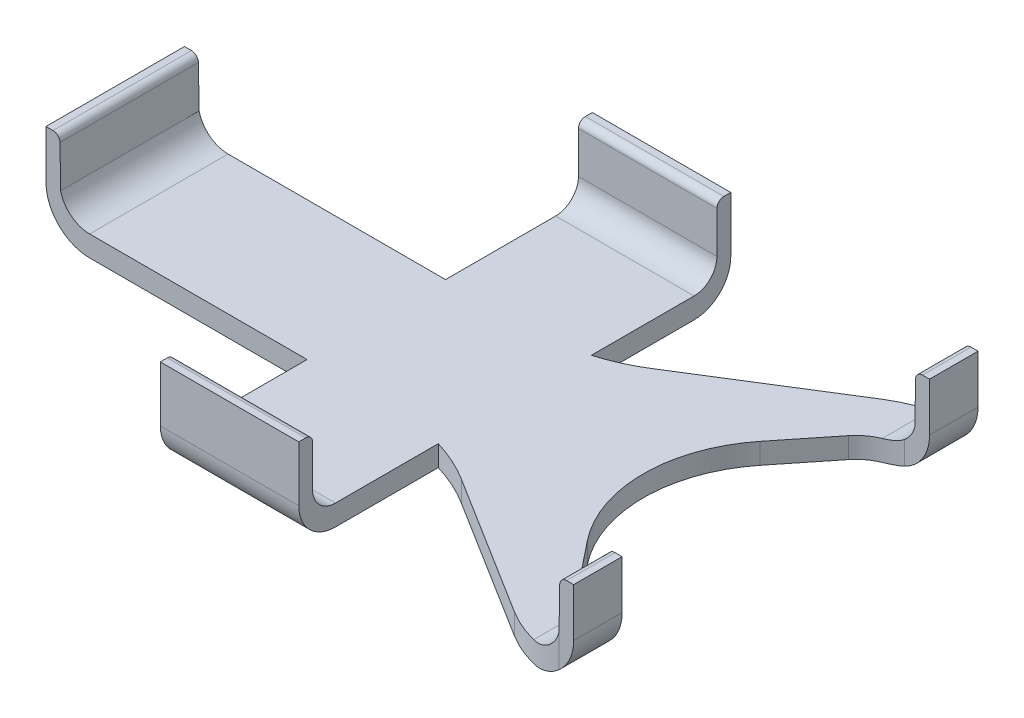
from build123d import *

# Parameters (mm, degrees)
BOSS_EXTRUDE1_DEPTH     = 30
FILLET2_R               = 1
FILLET2_OF_MIRROR4_R    = 1
CUT_EXTRUDE2_DEPTH      = 10.3
CUT_EXTRUDE2_DEPTH_BACK = 3
SKETCH4_OUTSIDE_W       = 120.12
SKETCH4_OUTSIDE_H       = 84.7
BOSS_EXTRUDE2_DEPTH     = 10
FILLET1_R               = 1
FILLET1_OF_MIRROR3_R    = 1


with BuildPart() as part:
    # Sketch3 → Boss-Extrude1 (new, symmetric)
    with BuildSketch(Plane.XY):
        with BuildLine():
            Line((-45.71, 2), (-45.59234107, -4.9990111))
            ThreePointArc((-45.59234107, -4.9990111), (-44.074043193, -7.375333149), (-41.41, -8.3))
            Line((-41.41, -8.3), (0, -8.3))
            Line((0, -8.3), (0, -11.3))
            Line((0, -11.3), (-41.41, -11.3))
            ThreePointArc((-41.41, -11.3), (-45.864772721, -9.454772721), (-47.71, -5))
            Line((-47.71, -5), (-47.71, 2))
            Line((-47.71, 2), (-45.71, 2))
        make_face()
    boss_extrude1 = extrude(amount=BOSS_EXTRUDE1_DEPTH, both=True)

    # Fillet2
    fillet2_edges = [part.edges().sort_by_distance(p)[0] for p in [
        (-45.71, 2, 0),
    ]]
    fillet(fillet2_edges, radius=FILLET2_R)

    # Mirror4: Boss-Extrude1 across plane
    add(boss_extrude1.mirror(Plane(origin=(0, 0, 0), x_dir=(0, 0, 1), z_dir=(1, 0, 0))))

    # Fillet2 of Mirror4
    fillet2_of_mirror4_edges = [part.edges().sort_by_distance(p)[0] for p in [
        (45.71, 2, 0),
    ]]
    fillet(fillet2_of_mirror4_edges, radius=FILLET2_OF_MIRROR4_R)

    # Sketch4 outside → Cut-Extrude2 (cut, two sides: drawn at the far end of the back side and taken through both)
    with BuildSketch(Plane(origin=(0, -8.3, 0), x_dir=(1, 0, 0), z_dir=(0, 1, 0)).offset(-CUT_EXTRUDE2_DEPTH_BACK)):
        Rectangle(SKETCH4_OUTSIDE_W, SKETCH4_OUTSIDE_H)
        with BuildLine():
            Line((-47.71, 10), (2.828114646, 10))
            ThreePointArc((2.828114646, 10), (9.721935767, 10.969285688), (16.081190316, 13.801981572))
            Line((16.081190316, 13.801981572), (36.574790585, 26.614652531))
            ThreePointArc((36.574790585, 26.614652531), (40.899083679, 28.540885732), (45.586882041, 29.2))
            Line((45.586882041, 29.2), (47.71, 29.2))
            Line((47.71, 29.2), (47.71, 22.2))
            Line((47.71, 22.2), (44.078732881, 22.2))
            ThreePointArc((44.078732881, 22.2), (41.043221434, 21.507588307), (38.608231021, 19.567334358))
            Line((38.608231021, 19.567334358), (32.948592182, 12.478098166))
            ThreePointArc((32.948592182, 12.478098166), (28.578597498, 0), (32.948592182, -12.478098166))
            Line((32.948592182, -12.478098166), (38.608231021, -19.567334358))
            ThreePointArc((38.608231021, -19.567334358), (41.043221434, -21.507588307), (44.078732881, -22.2))
            Line((44.078732881, -22.2), (47.71, -22.2))
            Line((47.71, -22.2), (47.71, -29.2))
            Line((47.71, -29.2), (45.586882041, -29.2))
            ThreePointArc((45.586882041, -29.2), (40.899083679, -28.540885732), (36.574790585, -26.614652531))
            Line((36.574790585, -26.614652531), (16.081190316, -13.801981572))
            ThreePointArc((16.081190316, -13.801981572), (9.721935767, -10.969285688), (2.828114646, -10))
            Line((2.828114646, -10), (-47.71, -10))
            Line((-47.71, -10), (-47.71, 10))
        make_face(mode=Mode.SUBTRACT)
    extrude(amount=CUT_EXTRUDE2_DEPTH + CUT_EXTRUDE2_DEPTH_BACK, mode=Mode.SUBTRACT)

    # Sketch2 → Boss-Extrude2 (add, symmetric)
    with BuildSketch(Plane(origin=(0, 0, 0), x_dir=(0, 0, -1), z_dir=(1, 0, 0))):
        with BuildLine():
            Line((-29.2, 2), (-29.2, -5))
            ThreePointArc((-29.2, -5), (-28.233452378, -7.333452378), (-25.9, -8.3))
            Line((-25.9, -8.3), (0, -8.3))
            Line((0, -8.3), (0, -11.3))
            Line((0, -11.3), (-25.9, -11.3))
            ThreePointArc((-25.9, -11.3), (-29.64766594, -9.74766594), (-31.2, -6))
            Line((-31.2, -6), (-31.2, 2))
            Line((-31.2, 2), (-29.2, 2))
        make_face()
    boss_extrude2 = extrude(amount=BOSS_EXTRUDE2_DEPTH, both=True)

    # Fillet1
    fillet1_edges = [part.edges().sort_by_distance(p)[0] for p in [
        (0, 2, 29.2),
    ]]
    fillet(fillet1_edges, radius=FILLET1_R)

    # Mirror3: Boss-Extrude2 across plane
    add(boss_extrude2.mirror(Plane.XY))

    # Fillet1 of Mirror3
    fillet1_of_mirror3_edges = [part.edges().sort_by_distance(p)[0] for p in [
        (0, 2, -29.2),
    ]]
    fillet(fillet1_of_mirror3_edges, radius=FILLET1_OF_MIRROR3_R)


solid = part.part
